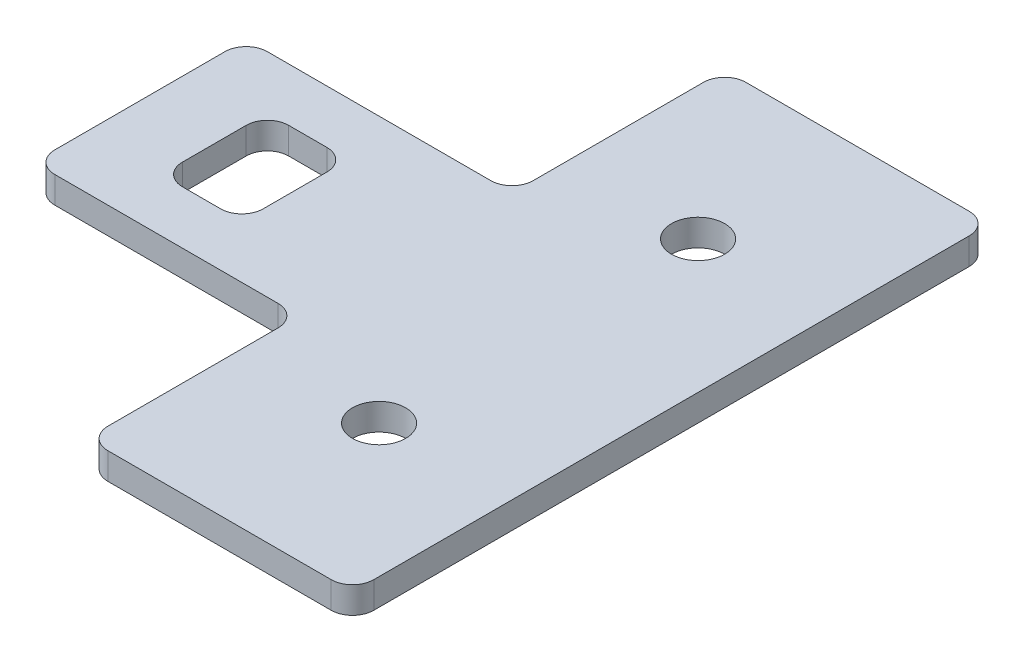
from build123d import *

# Parameters (mm, degrees)
SKETCH1_R           = 3.175
BOSS_EXTRUDE1_DEPTH = 3.175


with BuildPart() as part:
    # Sketch1 → Boss-Extrude1 (new body)
    with BuildSketch(Plane(origin=(0, 0, 0), x_dir=(1, 0, 0), z_dir=(0, 1, 0))):
        with BuildLine():
            Line((2.54, -38.1), (29.21, -38.1))
            ThreePointArc((29.21, -38.1), (31.006051224, -37.356051224), (31.75, -35.56))
            Line((31.75, -35.56), (31.75, 35.56))
            ThreePointArc((31.75, 35.56), (31.006051224, 37.356051224), (29.21, 38.1))
            Line((29.21, 38.1), (2.54, 38.1))
            ThreePointArc((2.54, 38.1), (0.743948776, 37.356051224), (0, 35.56))
            Line((0, 35.56), (0, 15.24))
            ThreePointArc((0, 15.24), (-0.743948776, 13.443948776), (-2.54, 12.7))
            Line((-2.54, 12.7), (-29.21, 12.7))
            ThreePointArc((-29.21, 12.7), (-31.006051224, 11.956051224), (-31.75, 10.16))
            Line((-31.75, 10.16), (-31.75, -10.16))
            ThreePointArc((-31.75, -10.16), (-31.006051224, -11.956051224), (-29.21, -12.7))
            Line((-29.21, -12.7), (-2.54, -12.7))
            ThreePointArc((-2.54, -12.7), (-0.743948776, -13.443948776), (0, -15.24))
            Line((0, -15.24), (0, -35.56))
            ThreePointArc((0, -35.56), (0.743948776, -37.356051224), (2.54, -38.1))
        make_face()
        with Locations(Location((15.875, 19.05, 0), (0, 0, 270))):
            Circle(SKETCH1_R, mode=Mode.SUBTRACT)
        with Locations(Location((15.875, -19.05, 0), (0, 0, 90))):
            Circle(SKETCH1_R, mode=Mode.SUBTRACT)
        with BuildLine():
            Line((-20.32, -6.35), (-15.748, -6.35))
            ThreePointArc((-15.748, -6.35), (-13.951948776, -5.606051224), (-13.208, -3.81))
            Line((-13.208, -3.81), (-13.208, 3.81))
            ThreePointArc((-13.208, 3.81), (-13.951948776, 5.606051224), (-15.748, 6.35))
            Line((-15.748, 6.35), (-20.32, 6.35))
            ThreePointArc((-20.32, 6.35), (-22.116051224, 5.606051224), (-22.86, 3.81))
            Line((-22.86, 3.81), (-22.86, -3.81))
            ThreePointArc((-22.86, -3.81), (-22.116051224, -5.606051224), (-20.32, -6.35))
        make_face(mode=Mode.SUBTRACT)
    extrude(amount=BOSS_EXTRUDE1_DEPTH)


solid = part.part
